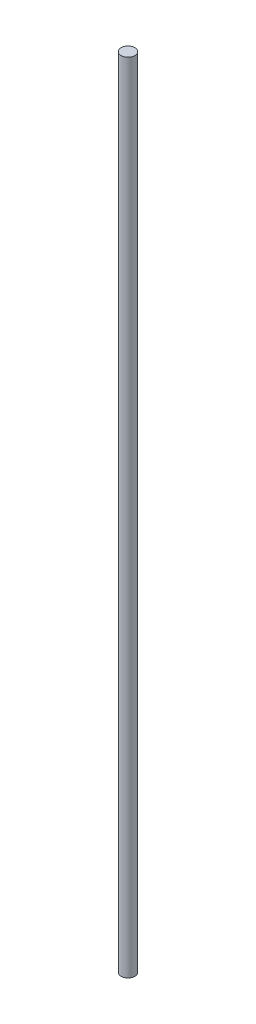
from build123d import *

# Parameters (mm, degrees)
SKETCH1_R           = 5
BOSS_EXTRUDE1_DEPTH = 580


with BuildPart() as part:
    # Sketch1 → Boss-Extrude1 (new body)
    with BuildSketch(Plane(origin=(0, 0, 0), x_dir=(1, 0, 0), z_dir=(0, 1, 0))):
        with Locations(Location((0, 0, 0), (0, 0, 270))):
            Circle(SKETCH1_R)
    extrude(amount=BOSS_EXTRUDE1_DEPTH)


solid = part.part
